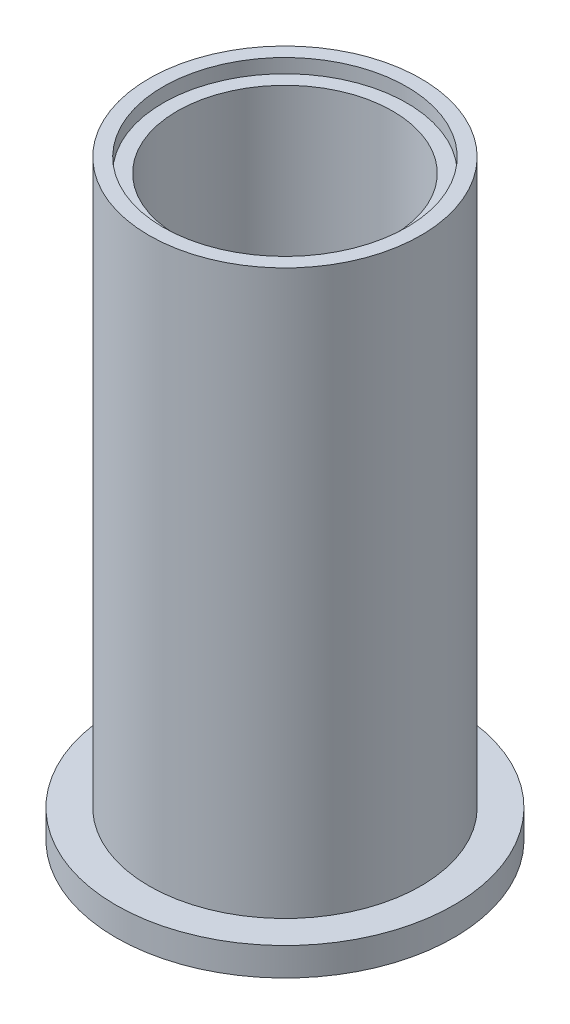
from build123d import *

# Parameters (mm, degrees)
SKETCH1_R           = 60
BOSS_EXTRUDE1_DEPTH = 10
SKETCH2_R           = 48.25
SKETCH2_R_2         = 38.25
BOSS_EXTRUDE2_DEPTH = 200
SKETCH3_R           = 43.25
CUT_EXTRUDE1_DEPTH  = 5


with BuildPart() as part:
    # Sketch1 → Boss-Extrude1 (new body)
    with BuildSketch(Plane(origin=(0, 0, 0), x_dir=(1, 0, 0), z_dir=(0, 1, 0))):
        with Locations(Location((0, 0, 0), (0, 0, 270))):
            Circle(SKETCH1_R)
    extrude(amount=BOSS_EXTRUDE1_DEPTH)

    # Sketch2 → Boss-Extrude2 (add)
    with BuildSketch(Plane(origin=(0, 10, 0), x_dir=(1, 0, 0), z_dir=(0, 1, 0))):
        with Locations(Location((0, 0, 0), (0, 0, 270))):
            Circle(SKETCH2_R)
        with Locations(Location((0, 0, 0), (0, 0, 270))):
            Circle(SKETCH2_R_2, mode=Mode.SUBTRACT)
    extrude(amount=BOSS_EXTRUDE2_DEPTH)

    # Sketch3 → Cut-Extrude1 (cut)
    with BuildSketch(Plane(origin=(0, 210, 0), x_dir=(1, 0, 0), z_dir=(0, 1, 0))):
        with Locations(Location((0, 0, 0), (0, 0, 270))):
            Circle(SKETCH3_R)
    extrude(amount=-CUT_EXTRUDE1_DEPTH, mode=Mode.SUBTRACT)


solid = part.part
